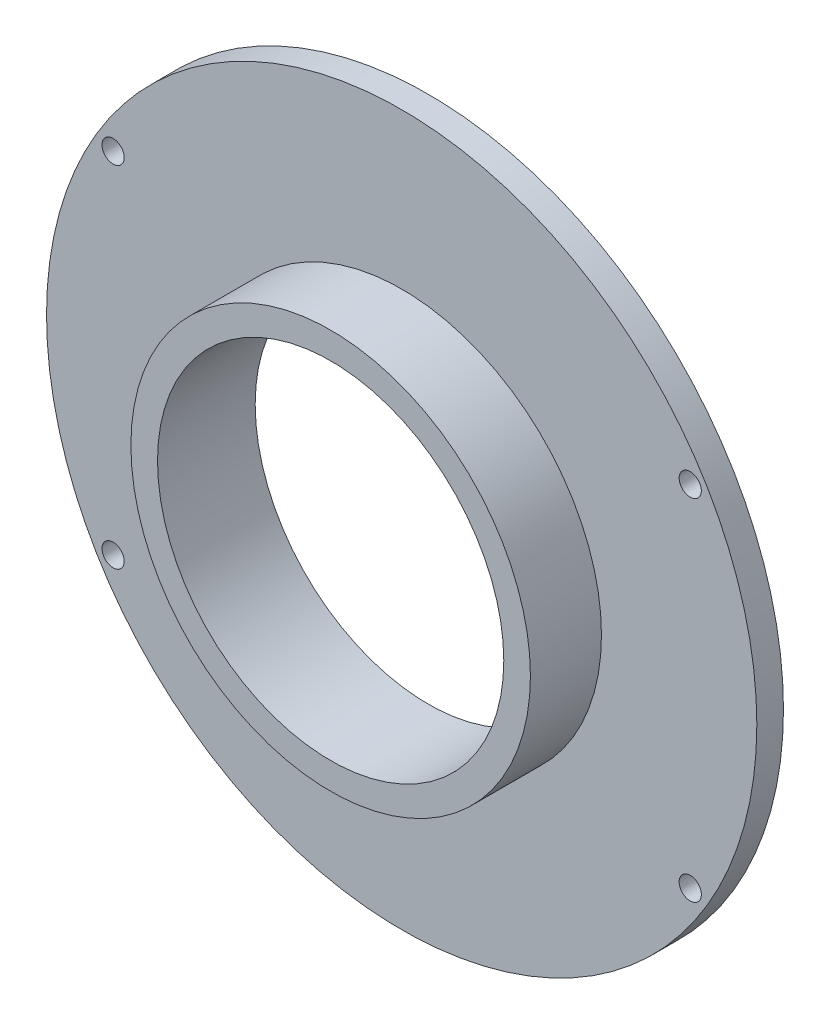
from build123d import *

# Parameters (mm, degrees)
SKETCH_1_R          = 22.5
EXTRUDE_1_DEPTH     = 8
SKETCH_2_R          = 40
EXTRUDE_2_DEPTH     = 3
SKETCH_4_R          = 19.5
CUT_EXTRUDE_2_DEPTH = 58.628118137
SKETCH_7_R          = 1.25
CUT_EXTRUDE_4_DEPTH = 58.628118137


with BuildPart() as part:
    # 草图1 → 凸台-拉伸1 (new body)
    with BuildSketch(Plane.XY):
        Circle(SKETCH_1_R)
    extrude(amount=EXTRUDE_1_DEPTH)

    # 草图2 → 凸台-拉伸2 (add)
    with BuildSketch(Plane(origin=(0, 0, 0), x_dir=(-1, 0, 0), z_dir=(0, 0, -1))):
        Circle(SKETCH_2_R)
    extrude(amount=EXTRUDE_2_DEPTH)

    # 草图4 → 切除-拉伸2 (cut, through all)
    with BuildSketch(Plane.XY.offset(8)):
        Circle(SKETCH_4_R)
    extrude(amount=-CUT_EXTRUDE_2_DEPTH, mode=Mode.SUBTRACT)

    # 草图7 → 切除-拉伸4 (cut, through all)
    with BuildSketch(Plane(origin=(0, 0, -3), x_dir=(-1, 0, 0), z_dir=(0, 0, -1))):
        with Locations((32.5, 19.691368668)):
            Circle(SKETCH_7_R)
        with Locations((-32.5, 19.691368668)):
            Circle(SKETCH_7_R)
        with Locations((32.5, -19.691368668)):
            Circle(SKETCH_7_R)
        with Locations((-32.5, -19.691368668)):
            Circle(SKETCH_7_R)
    extrude(amount=-CUT_EXTRUDE_4_DEPTH, mode=Mode.SUBTRACT)


solid = part.part
